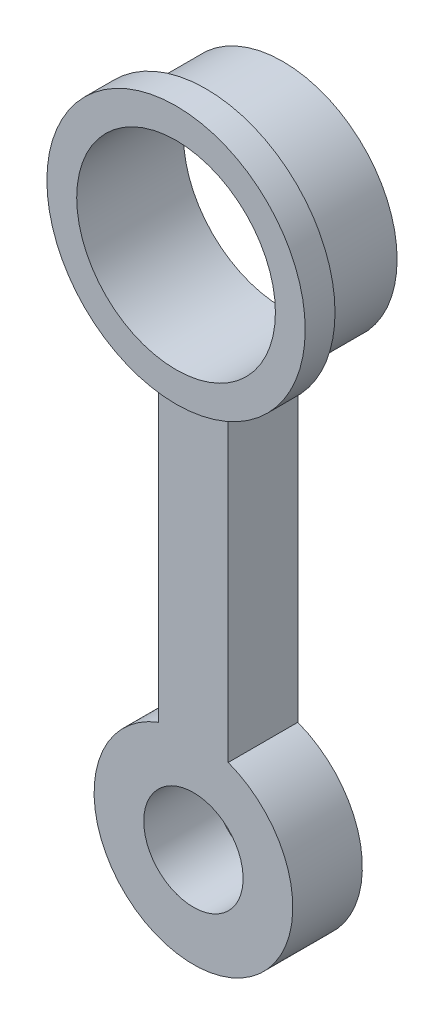
from build123d import *

# Parameters (mm, degrees)
CROQUIS1_R               = 10
SALIENTE_EXTRUIR1_DEPTH  = 3
CROQUIS2_R               = 11.5
CROQUIS2_R_2             = 10
SALIENTE_EXTRUIR3_DEPTH  = 8
SALIENTE_EXTRUIR4_START  = 3
CROQUIS3_R               = 11.5
CROQUIS3_R_2             = 10
SALIENTE_EXTRUIR4_DEPTH  = 3
SALIENTE_EXTRUIR5_DEPTH  = 8
CROQUIS11_W              = 0.560242515
CROQUIS11_H              = 6
CORTAR_EXTRUIR3_DEPTH    = 8
CROQUIS12_W              = 2.5
CROQUIS12_H              = 0.622045166
SALIENTE_EXTRUIR6_DEPTH  = 3
CROQUIS13_W              = 5
CROQUIS13_H              = 50.27502784
SALIENTE_EXTRUIR7_DEPTH  = 8
CROQUIS15_W              = 2
CROQUIS15_H              = 50.27502784
CORTAR_EXTRUIR4_DEPTH    = 8
SALIENTE_EXTRUIR8_DEPTH  = 7
CROQUIS21_R              = 10
SALIENTE_EXTRUIR9_DEPTH  = 7
CROQUIS22_R              = 5
CORTAR_EXTRUIR5_DEPTH    = 30
CROQUIS23_R              = 10
SALIENTE_EXTRUIR10_DEPTH = 1.25
CORTAR_EXTRUIR6_START    = -1.5
CROQUIS24_R              = 10
CORTAR_EXTRUIR6_DEPTH    = 1.5
SALIENTE_EXTRUIR11_START = -3
CROQUIS25_R              = 13
SALIENTE_EXTRUIR11_DEPTH = 3
CORTAR_EXTRUIR14_START   = -10
CROQUIS30_R              = 10
CORTAR_EXTRUIR14_DEPTH   = 10
CROQUIS31_R              = 11.5
CROQUIS31_R_2            = 10
SALIENTE_EXTRUIR12_DEPTH = 7.75


with BuildPart() as part:
    # Croquis1 → Saliente-Extruir1 (new body)
    with BuildSketch(Plane.XY):
        Circle(CROQUIS1_R)
    extrude(amount=SALIENTE_EXTRUIR1_DEPTH)



with BuildPart() as body_2:
    # Croquis2 → Saliente-Extruir3 (new body)
    with BuildSketch(Plane.XY.offset(3)):
        Circle(CROQUIS2_R)
        Circle(CROQUIS2_R_2, mode=Mode.SUBTRACT)
    extrude(amount=SALIENTE_EXTRUIR3_DEPTH)


with BuildPart() as part_1:
    add(part.part)

    add(body_2.part)  # Saliente-Extruir4 merges body 2
    # Croquis3 → Saliente-Extruir4 (add)
    with BuildSketch(Plane(origin=(0, 0, 3), x_dir=(-1, 0, 0), z_dir=(0, 0, -1)).offset(SALIENTE_EXTRUIR4_START)):
        with Locations(Location((0, 0, 0), (0, 0, 180))):
            Circle(CROQUIS3_R)
        with Locations(Location((0, 0, 0), (0, 0, 180))):
            Circle(CROQUIS3_R_2, mode=Mode.SUBTRACT)
    extrude(amount=-SALIENTE_EXTRUIR4_DEPTH)

    # Croquis12 → Saliente-Extruir6 (add)
    with BuildSketch(Plane.XY.offset(3)):
        with Locations((-1.25, -11.188977417)):
            Rectangle(CROQUIS12_W, CROQUIS12_H)
        with Locations((1.25, -11.188977417)):
            Rectangle(CROQUIS12_W, CROQUIS12_H)
        Polygon((2.5, -11.5), (2.5, -61.5), (-2.5, -61.5), (-2.5, -11.5), (0, -11.5), align=None)
    extrude(amount=-SALIENTE_EXTRUIR6_DEPTH)

    # Croquis13 → Saliente-Extruir7 (add)
    with BuildSketch(Plane.XY.offset(3)):
        with Locations((0, -36.36248608)):
            Rectangle(CROQUIS13_W, CROQUIS13_H)
    extrude(amount=SALIENTE_EXTRUIR7_DEPTH)

    # Croquis15 → Cortar-Extruir4 (cut)
    with BuildSketch(Plane(origin=(2.5, 0, 0), x_dir=(0, 0, -1), z_dir=(1, 0, 0))):
        with Locations((-10, -36.36248608)):
            Rectangle(CROQUIS15_W, CROQUIS15_H)
        with Locations((-1, -36.36248608)):
            Rectangle(CROQUIS15_W, CROQUIS15_H)
    extrude(amount=-CORTAR_EXTRUIR4_DEPTH, mode=Mode.SUBTRACT)

    # Croquis16 → Saliente-Extruir8 (add)
    with BuildSketch(Plane.XY.offset(9)):
        Polygon((-2.5, -61.5), (-3.5, -61.5), (-3.5, -10.232955502), (3.5, -10.232955502), (3.5, -61.5), (2.5, -61.5), align=None)
    extrude(amount=-SALIENTE_EXTRUIR8_DEPTH)

    # Croquis21 → Saliente-Extruir9 (add)
    with BuildSketch(Plane(origin=(0, 0, 2), x_dir=(-1, 0, 0), z_dir=(0, 0, -1))):
        with Locations((0, -52.72497216)):
            Circle(CROQUIS21_R)
    extrude(amount=-SALIENTE_EXTRUIR9_DEPTH)

    # Croquis22 → Cortar-Extruir5 (cut)
    with BuildSketch(Plane(origin=(0, 0, 2), x_dir=(-1, 0, 0), z_dir=(0, 0, -1))):
        with Locations((0, -52.72497216)):
            Circle(CROQUIS22_R)
    extrude(amount=-CORTAR_EXTRUIR5_DEPTH, mode=Mode.SUBTRACT)

    # Croquis23 → Saliente-Extruir10 (add)
    with BuildSketch(Plane.XY.offset(11)):
        with BuildLine():
            Line((-2.5, -11.22497216), (2.5, -11.22497216))
            ThreePointArc((2.5, -11.22497216), (0, 11.5), (-2.5, -11.22497216))
        make_face()
        Circle(CROQUIS23_R, mode=Mode.SUBTRACT)
    extrude(amount=SALIENTE_EXTRUIR10_DEPTH)

    # Croquis24 → Cortar-Extruir6 (cut)
    with BuildSketch(Plane.XY.offset(12.25).offset(CORTAR_EXTRUIR6_START)):
        with BuildLine():
            Line((-2.5, -11.22497216), (2.5, -11.22497216))
            ThreePointArc((2.5, -11.22497216), (0, 11.5), (-2.5, -11.22497216))
        make_face()
        Circle(CROQUIS24_R, mode=Mode.SUBTRACT)
    extrude(amount=CORTAR_EXTRUIR6_DEPTH, mode=Mode.SUBTRACT)

    # Croquis25 → Saliente-Extruir11 (add)
    with BuildSketch(Plane.XY.offset(10.75).offset(SALIENTE_EXTRUIR11_START)):
        Circle(CROQUIS25_R)
        with BuildLine():
            ThreePointArc((2.5, -11.22497216), (0, 11.5), (-2.5, -11.22497216))
            Line((-2.5, -11.22497216), (2.5, -11.22497216))
        make_face(mode=Mode.SUBTRACT)
    extrude(amount=SALIENTE_EXTRUIR11_DEPTH)

    # Croquis30 → Cortar-Extruir14 (cut)
    with BuildSketch(Plane.XY.offset(3).offset(CORTAR_EXTRUIR14_START)):
        Circle(CROQUIS30_R)
    extrude(amount=CORTAR_EXTRUIR14_DEPTH, mode=Mode.SUBTRACT)

    # Croquis31 → Saliente-Extruir12 (add)
    with BuildSketch(Plane(origin=(0, 0, 0), x_dir=(-1, 0, 0), z_dir=(0, 0, -1))):
        with Locations(Location((0, 0, 0), (0, 0, 180))):
            Circle(CROQUIS31_R)
        with Locations(Location((0, 0, 0), (0, 0, 180))):
            Circle(CROQUIS31_R_2, mode=Mode.SUBTRACT)
    extrude(amount=-SALIENTE_EXTRUIR12_DEPTH)


with BuildPart() as body_2_2:
    # Croquis9 → Saliente-Extruir5 (new body)
    with BuildSketch(Plane.XY.offset(11)):
        Polygon((11.5, 0), (11.5, 3), (12.060242515, 3), (12.060242515, -3), (11.5, -3), align=None)
    extrude(amount=-SALIENTE_EXTRUIR5_DEPTH)

    # Croquis11 → Cortar-Extruir3 (cut)
    with BuildSketch(Plane.XY.offset(11)):
        with Locations((11.780121257, 0)):
            Rectangle(CROQUIS11_W, CROQUIS11_H)
    extrude(amount=-CORTAR_EXTRUIR3_DEPTH, mode=Mode.SUBTRACT)


solid = part_1.part
